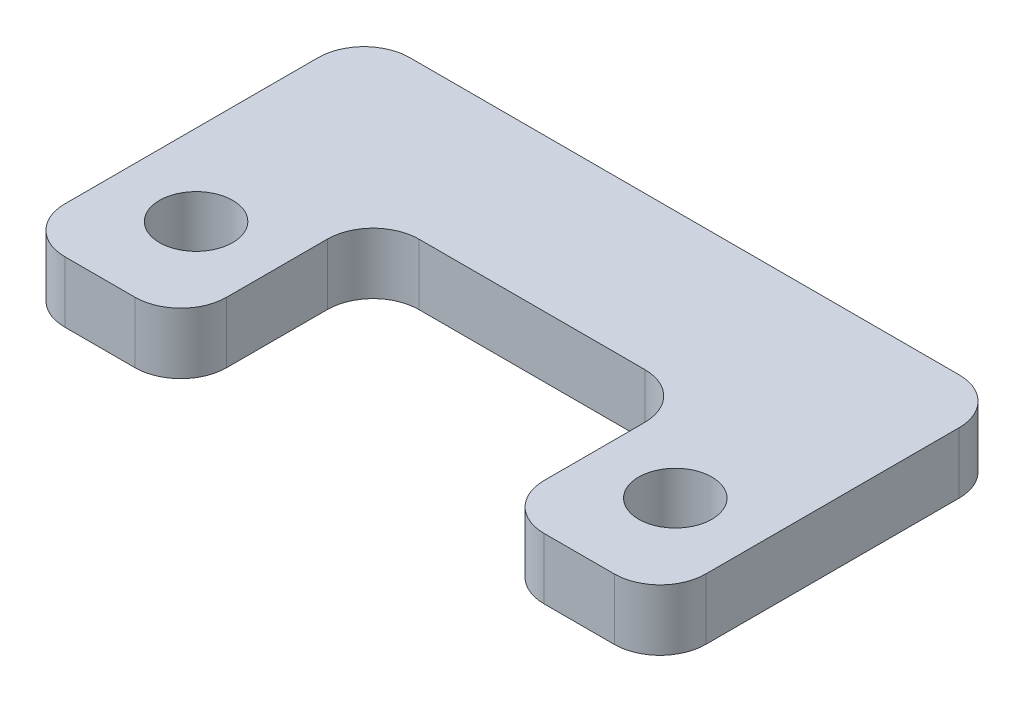
from build123d import *

# Parameters (mm, degrees)
BOSS_EXTRUDE1_DEPTH  = 2
M2_CLEARANCE_HOLE1_D = 2.4
FILLET1_R            = 1.5


with BuildPart() as part:
    # Sketch1 → Boss-Extrude1 (new body)
    with BuildSketch(Plane(origin=(0, 0, 0), x_dir=(1, 0, 0), z_dir=(0, 1, 0))):
        Polygon((-10.5, 2.5), (10.5, 2.5), (10.5, -2.5), (10.5, -8.8), (5.2, -8.8), (5.2, -2.5), (-5.2, -2.5), (-5.2, -8.8), (-10.5, -8.8), (-10.5, -2.5), align=None)
    extrude(amount=BOSS_EXTRUDE1_DEPTH)

    # M2 Clearance Hole1 (through all)
    with Locations(Plane(origin=(0, 2, 0), x_dir=(1, 0, 0), z_dir=(0, 1, 0))):
        with Locations((-7.85, -5.65), (7.85, -5.65)):
            Hole(M2_CLEARANCE_HOLE1_D / 2)

    # Fillet1
    fillet1_edges = [part.edges().sort_by_distance(p)[0] for p in [
        (10.5, 1, 8.8),
        (5.2, 1, 8.8),
        (5.2, 1, 2.5),
        (-5.2, 1, 2.5),
        (-5.2, 1, 8.8),
        (-10.5, 1, 8.8),
        (-10.5, 1, -2.5),
        (10.5, 1, -2.5),
    ]]
    fillet(fillet1_edges, radius=FILLET1_R)


solid = part.part
